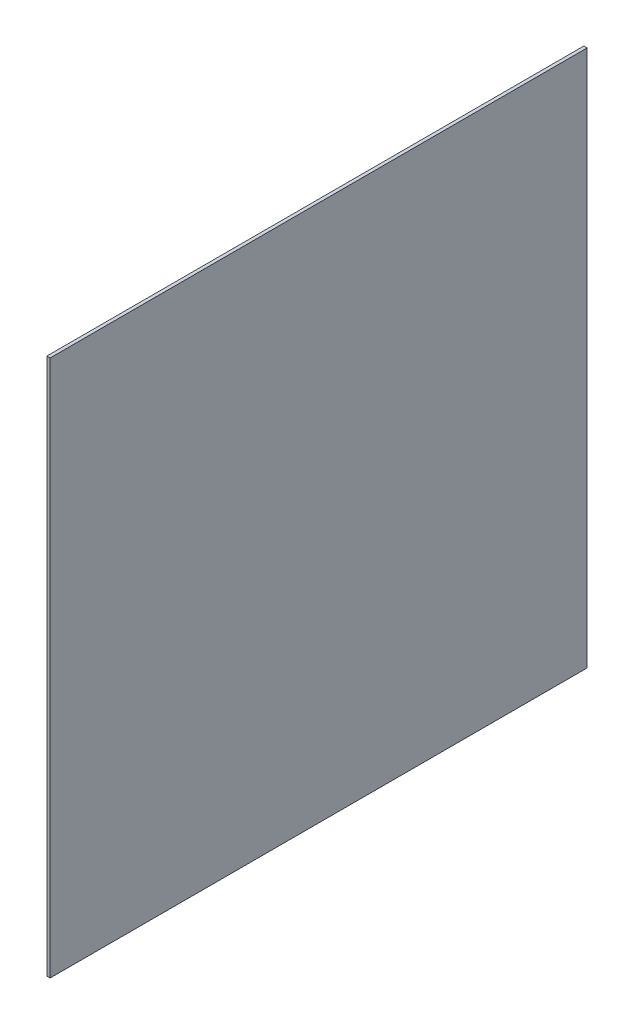
from build123d import *

# Parameters (mm, degrees)
SKETCH2_W           = 130.8
SKETCH2_H           = 130.8
BOSS_EXTRUDE1_DEPTH = 0.8


with BuildPart() as part:
    # Sketch2 → Boss-Extrude1 (new body)
    with BuildSketch(Plane(origin=(0, 0, 0), x_dir=(0, 0, -1), z_dir=(1, 0, 0))):
        Rectangle(SKETCH2_W, SKETCH2_H)
    extrude(amount=BOSS_EXTRUDE1_DEPTH)


solid = part.part
